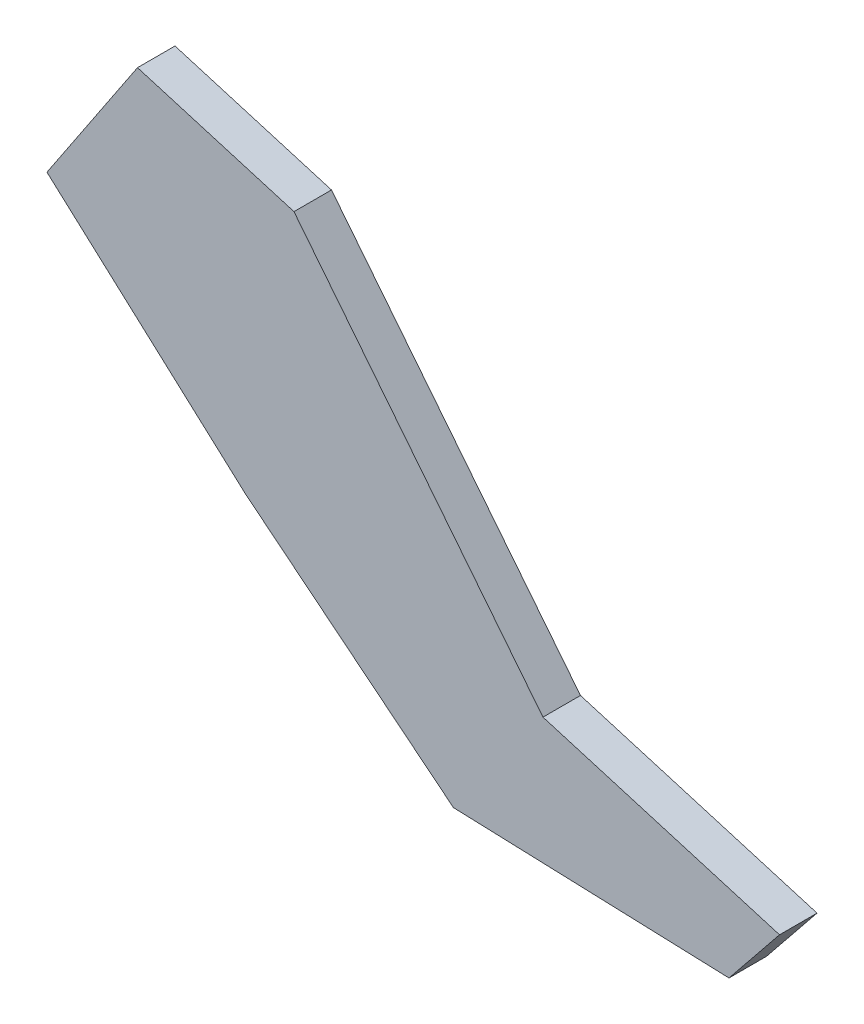
from build123d import *

# Parameters (mm, degrees)
BOSS_EXTRUDE1_DEPTH      = 3.175
BOSS_EXTRUDE1_DEPTH_BACK = 3.175


with BuildPart() as part:
    # Sketch1 → Boss-Extrude1 (new, two sides: drawn at the far end of the back side and taken through both)
    with BuildSketch(Plane.XY.offset(-BOSS_EXTRUDE1_DEPTH_BACK)):
        Polygon((732.835479136, 222.864021495), (759.323844019, 215.00483631), (801.46975639, 161.967283663), (841.51612548, 150.085393933), (832.960803274, 139.473678746), (786.31616992, 141.131102266), (751.111381007, 169.513725343), (717.508912563, 199.874171636), align=None)
    extrude(amount=BOSS_EXTRUDE1_DEPTH + BOSS_EXTRUDE1_DEPTH_BACK)


solid = part.part
